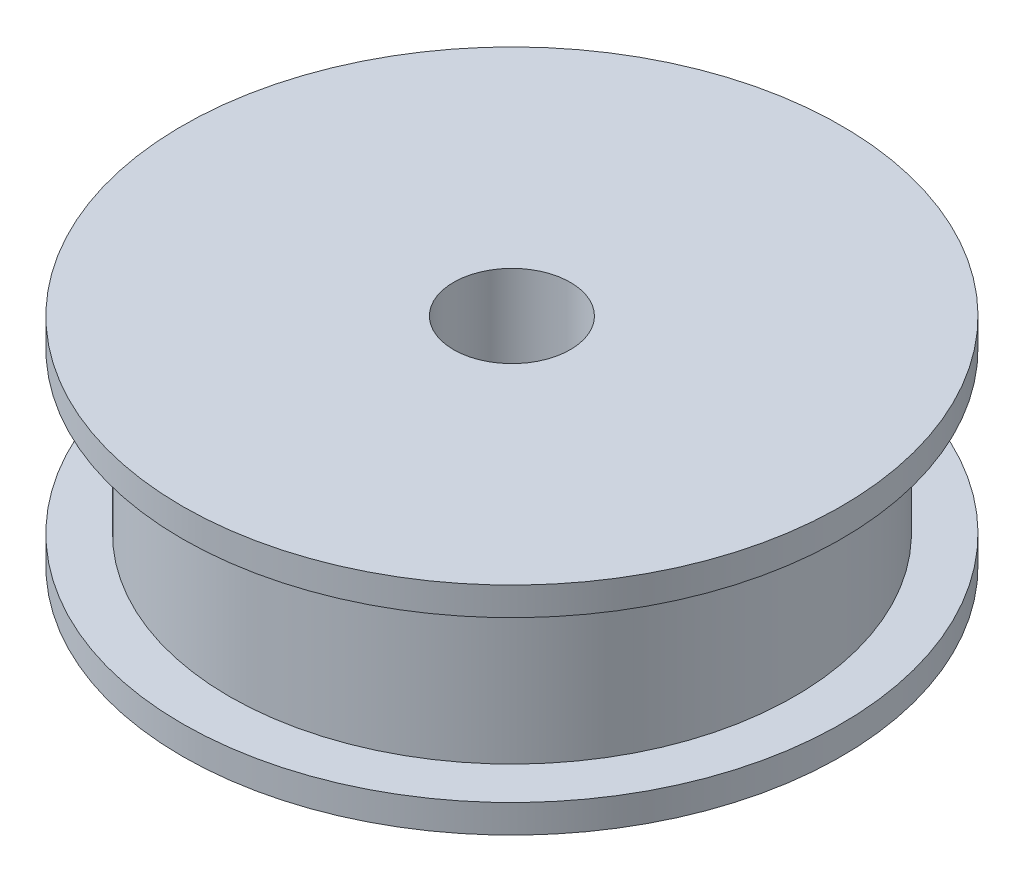
from build123d import *

# Parameters (mm, degrees)
SKETCH_205_R        = 15
EXTRUDE_1_DEPTH     = 5
EXTRUDE_START       = 5
SKETCH_286_R        = 17.5
EXTRUDE_1_2_DEPTH   = 1.5
EXTRUDE_START_2     = -5
SKETCH_2_2_R        = 17.5
EXTRUDE_2_DEPTH     = 1.5
SKETCH_407_R        = 3.1
CUT_EXTRUDE_1_DEPTH = 6.5


with BuildPart() as part:
    # Sketch 205 → Extrude 1 (new, symmetric)
    with BuildSketch(Plane(origin=(0, 0, 0), x_dir=(1, 0, 0), z_dir=(0, 1, 0))):
        with Locations(Location((0, 0, 0), (0, 0, 270))):
            Circle(SKETCH_205_R)
    extrude(amount=EXTRUDE_1_DEPTH, both=True)

    # Sketch 286 → Extrude 1 2 (add)
    with BuildSketch(Plane(origin=(0, 0, 0), x_dir=(1, 0, 0), z_dir=(0, 1, 0)).offset(EXTRUDE_START)):
        with Locations(Location((0, 0, 0), (0, 0, 270))):
            Circle(SKETCH_286_R)
    extrude(amount=EXTRUDE_1_2_DEPTH)

    # 草图2<2> → 边缘2 (add)
    with BuildSketch(Plane(origin=(0, 0, 0), x_dir=(1, 0, 0), z_dir=(0, 1, 0)).offset(EXTRUDE_START_2)):
        with Locations(Location((0, 0, 0), (0, 0, 270))):
            Circle(SKETCH_2_2_R)
    extrude(amount=EXTRUDE_2_DEPTH)

    # Sketch 407 → 切除-拉伸1 (cut, symmetric)
    with BuildSketch(Plane(origin=(0, 0, 0), x_dir=(1, 0, 0), z_dir=(0, 1, 0))):
        with Locations(Location((0, 0, 0), (0, 0, 270))):
            Circle(SKETCH_407_R)
    extrude(amount=CUT_EXTRUDE_1_DEPTH, both=True, mode=Mode.SUBTRACT)


solid = part.part
